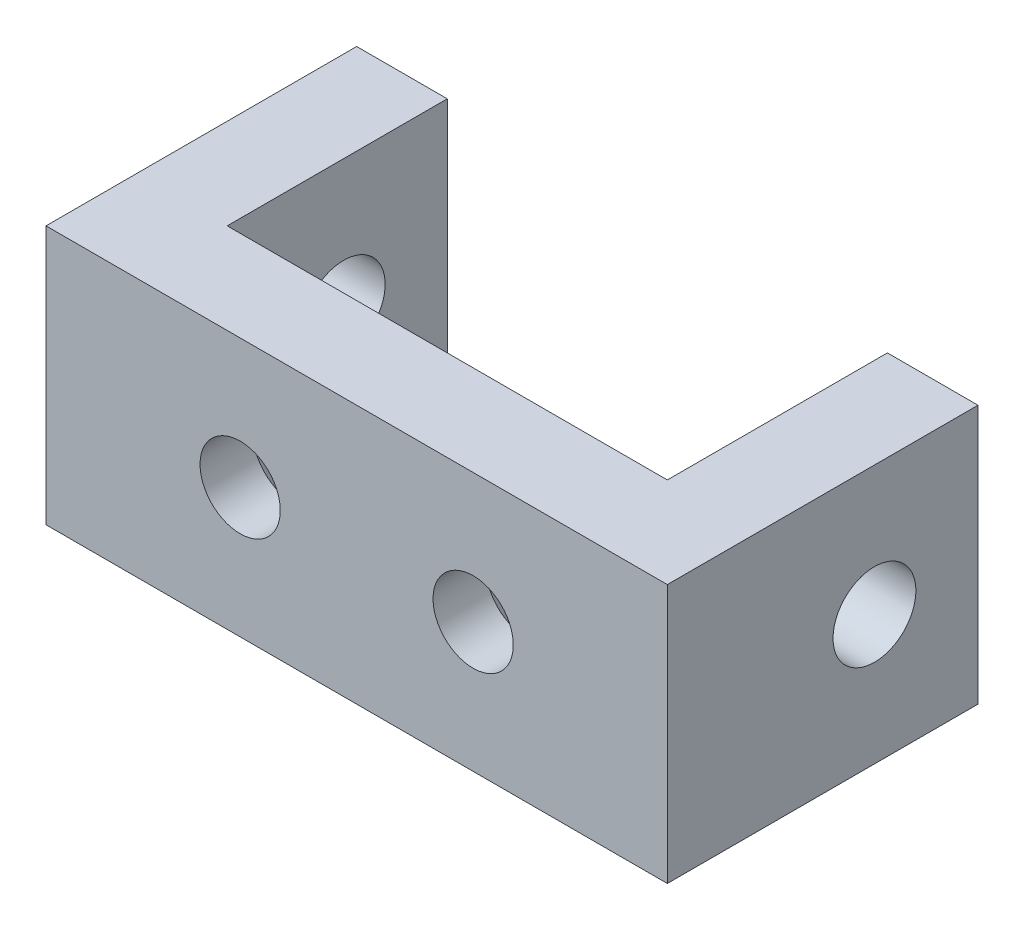
from build123d import *

# Parameters (mm, degrees)
SKETCH1_W                                           = 17
SKETCH1_H                                           = 3.5
BOSS_EXTRUDE1_DEPTH                                 = 10
SKETCH2_R                                           = 1.6
CUT_EXTRUDE1_DEPTH                                  = 28.947495416
SKETCH3_R                                           = 1.5
CUT_EXTRUDE2_DEPTH                                  = 18.783419244
CSK_FOR_M4_COUNTERSUNK_FLAT_HEAD_SCREW1_D           = 3.1
CSK_FOR_M4_COUNTERSUNK_FLAT_HEAD_SCREW1_CSINK_D     = 6
CSK_FOR_M4_COUNTERSUNK_FLAT_HEAD_SCREW1_CSINK_ANGLE = 90


with BuildPart() as part:
    # Sketch1 → Boss-Extrude1 (new body)
    with BuildSketch(Plane(origin=(0, 0, 0), x_dir=(1, 0, 0), z_dir=(0, 1, 0))):
        Polygon((-12, -1.75), (-8.5, -1.75), (-8.5, 1.75), (-8.5, 10.25), (-12, 10.25), align=None)
        Rectangle(SKETCH1_W, SKETCH1_H)
        Polygon((8.5, 1.75), (8.5, -1.75), (12, -1.75), (12, 10.25), (8.5, 10.25), align=None)
    extrude(amount=BOSS_EXTRUDE1_DEPTH)

    # Sketch2 → Cut-Extrude1 (cut, through all)
    with BuildSketch(Plane.ZY.offset(12)):
        with Locations((-6.25, 5)):
            Circle(SKETCH2_R)
    extrude(amount=-CUT_EXTRUDE1_DEPTH, mode=Mode.SUBTRACT)

    # Sketch3 → Cut-Extrude2 (cut, through all)
    with BuildSketch(Plane(origin=(0, 0, -1.75), x_dir=(-1, 0, 0), z_dir=(0, 0, -1))):
        with Locations((-4.5, 5)):
            Circle(SKETCH3_R)
        with Locations((4.5, 5)):
            Circle(SKETCH3_R)
    extrude(amount=-CUT_EXTRUDE2_DEPTH, mode=Mode.SUBTRACT)

    # CSK for M4 Countersunk Flat Head Screw1 (through all)
    with Locations(Plane(origin=(4.5, 5, -1.75), x_dir=(-1, 0, 0), z_dir=(0, 0, -1))):
        with Locations((0, 0), (9, 0)):
            CounterSinkHole(CSK_FOR_M4_COUNTERSUNK_FLAT_HEAD_SCREW1_D / 2, CSK_FOR_M4_COUNTERSUNK_FLAT_HEAD_SCREW1_CSINK_D / 2, counter_sink_angle=CSK_FOR_M4_COUNTERSUNK_FLAT_HEAD_SCREW1_CSINK_ANGLE)


solid = part.part
